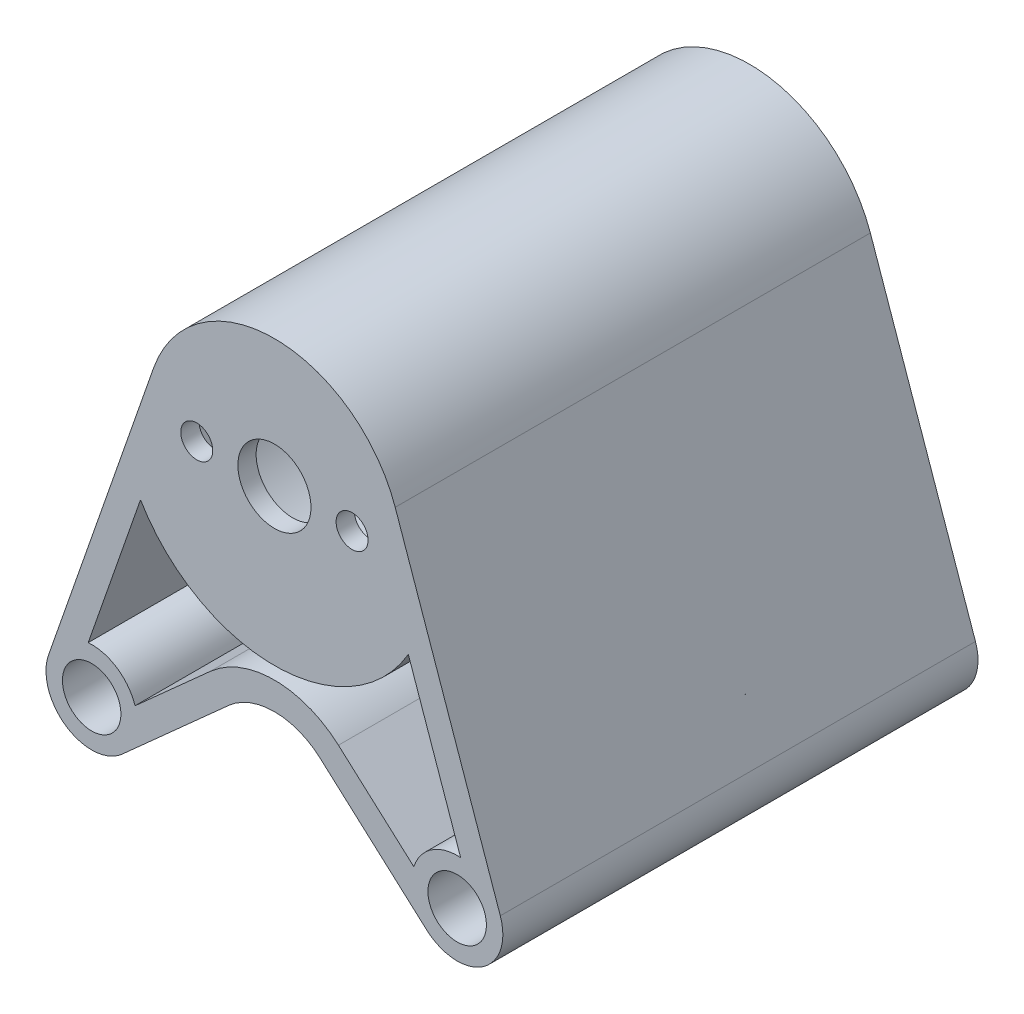
from build123d import *

# Parameters (mm, degrees)
SKETCH3_R           = 14
SKETCH3_R_2         = 1.75
SKETCH3_R_3         = 4
BOSS_EXTRUDE1_DEPTH = 2
BOSS_EXTRUDE2_START = 50
SKETCH4_R           = 14
SKETCH4_R_2         = 12.65
BOSS_EXTRUDE2_DEPTH = 50
BOSS_EXTRUDE3_START = -52
SKETCH5_R           = 3
BOSS_EXTRUDE3_DEPTH = 52
SKETCH6_R           = 13.15
CUT_EXTRUDE1_DEPTH  = 50
SKETCH8_R           = 3.2
SKETCH8_R_2         = 3
CUT_EXTRUDE2_DEPTH  = 52


with BuildPart() as part:
    # Sketch3 → Boss-Extrude1 (new body)
    with BuildSketch(Plane.XY):
        Circle(SKETCH3_R)
        with Locations((8.5, 0)):
            Circle(SKETCH3_R_2, mode=Mode.SUBTRACT)
        with Locations((-8.5, 0)):
            Circle(SKETCH3_R_2, mode=Mode.SUBTRACT)
        Circle(SKETCH3_R_3, mode=Mode.SUBTRACT)
    extrude(amount=BOSS_EXTRUDE1_DEPTH)

    # Sketch4 → Boss-Extrude2 (add)
    with BuildSketch(Plane(origin=(0, 0, 0), x_dir=(-1, 0, 0), z_dir=(0, 0, -1)).offset(BOSS_EXTRUDE2_START)):
        Circle(SKETCH4_R)
        Circle(SKETCH4_R_2, mode=Mode.SUBTRACT)
    extrude(amount=-BOSS_EXTRUDE2_DEPTH)

    # Sketch5 → Boss-Extrude3 (add)
    # profile 1 of 4: a face of its own
    with BuildSketch(Plane.XY.offset(2).offset(BOSS_EXTRUDE3_START)):
        with BuildLine():
            Line((24.720866981, -28.352755346), (13.218427546, 4.612285031))
            ThreePointArc((13.218427546, 4.612285031), (13.803224001, 2.339018422), (14, 0))
            ThreePointArc((14, 0), (-2.339018422, -13.803224001), (-13.218427546, 4.612285031))
            Line((-13.218427546, 4.612285031), (-24.720866981, -28.352755346))
            ThreePointArc((-24.720866981, -28.352755346), (-23.047527639, -26.036090908), (-20.378622129, -25.014356081))
            Line((-20.378622129, -25.014356081), (-14.656053545, -8.613947671))
            ThreePointArc((-14.656053545, -8.613947671), (0, -17), (14.656053545, -8.613947671))
            Line((14.656053545, -8.613947671), (20.378622129, -25.014356081))
            ThreePointArc((20.378622129, -25.014356081), (23.047527639, -26.036090908), (24.720866981, -28.352755346))
        make_face()
    # profile 2 of 4: a face of its own
    with BuildSketch(Plane.XY.offset(2).offset(BOSS_EXTRUDE3_START)):
        with BuildLine():
            Line((5.004377394, -23.279258169), (16.663748404, -33.724167731))
            ThreePointArc((16.663748404, -33.724167731), (15.168880977, -31.288522016), (15.252243256, -28.431941997))
            Line((15.252243256, -28.431941997), (7.006128352, -21.044757531))
            ThreePointArc((7.006128352, -21.044757531), (0, -18.365509765), (-7.006128352, -21.044757531))
            Line((-7.006128352, -21.044757531), (-15.252243256, -28.431941997))
            ThreePointArc((-15.252243256, -28.431941997), (-15.063463577, -29.205891607), (-15, -30))
            ThreePointArc((-15, -30), (-15.434846225, -32.039453606), (-16.663748404, -33.724167731))
            Line((-16.663748404, -33.724167731), (-5.004377394, -23.279258169))
            ThreePointArc((-5.004377394, -23.279258169), (0, -21.365509765), (5.004377394, -23.279258169))
        make_face()
    # profile 3 of 4: a face of its own
    with BuildSketch(Plane.XY.offset(2).offset(BOSS_EXTRUDE3_START)):
        with BuildLine():
            ThreePointArc((-20.378622129, -25.014356081), (-23.047527639, -26.036090908), (-24.720866981, -28.352755346))
            ThreePointArc((-24.720866981, -28.352755346), (-22.773500981, -34.160251472), (-16.663748404, -33.724167731))
            ThreePointArc((-16.663748404, -33.724167731), (-15.434846225, -32.039453606), (-15, -30))
            ThreePointArc((-15, -30), (-15.063463577, -29.205891607), (-15.252243256, -28.431941997))
            ThreePointArc((-15.252243256, -28.431941997), (-17.226499019, -25.839748528), (-20.378622129, -25.014356081))
        make_face()
        with Locations((-20, -30)):
            Circle(SKETCH5_R, mode=Mode.SUBTRACT)
    # profile 4 of 4: a face of its own
    with BuildSketch(Plane.XY.offset(2).offset(BOSS_EXTRUDE3_START)):
        with BuildLine():
            ThreePointArc((25, -30), (24.929722858, -29.164636278), (24.720866981, -28.352755346))
            ThreePointArc((24.720866981, -28.352755346), (23.047527639, -26.036090908), (20.378622129, -25.014356081))
            ThreePointArc((20.378622129, -25.014356081), (17.226499019, -25.839748528), (15.252243256, -28.431941997))
            ThreePointArc((15.252243256, -28.431941997), (15.168880977, -31.288522016), (16.663748404, -33.724167731))
            ThreePointArc((16.663748404, -33.724167731), (22.039453606, -34.565153775), (25, -30))
        make_face()
        with Locations((20, -30)):
            Circle(SKETCH5_R, mode=Mode.SUBTRACT)
    extrude(amount=BOSS_EXTRUDE3_DEPTH)

    # Sketch6 → Cut-Extrude1 (cut)
    with BuildSketch(Plane(origin=(0, 0, -50), x_dir=(-1, 0, 0), z_dir=(0, 0, -1))):
        Circle(SKETCH6_R)
    extrude(amount=-CUT_EXTRUDE1_DEPTH, mode=Mode.SUBTRACT)

    # Sketch8 → Cut-Extrude2 (cut)
    # profile 1 of 4: a face of its own
    with BuildSketch(Plane(origin=(0, 0, -50), x_dir=(-1, 0, 0), z_dir=(0, 0, -1))):
        with Locations((20, -30)):
            Circle(SKETCH8_R)
        with Locations((20, -30)):
            Circle(SKETCH8_R_2, mode=Mode.SUBTRACT)
    # profile 2 of 4: a face of its own
    with BuildSketch(Plane(origin=(0, 0, -50), x_dir=(-1, 0, 0), z_dir=(0, 0, -1))):
        with Locations((-20, -30)):
            Circle(SKETCH8_R)
        with Locations((-20, -30)):
            Circle(SKETCH8_R_2, mode=Mode.SUBTRACT)
    # profile 3 of 4: a face of its own
    with BuildSketch(Plane(origin=(0, 0, -50), x_dir=(-1, 0, 0), z_dir=(0, 0, -1))):
        with Locations((20, -30)):
            Circle(SKETCH8_R_2)
    # profile 4 of 4: a face of its own
    with BuildSketch(Plane(origin=(0, 0, -50), x_dir=(-1, 0, 0), z_dir=(0, 0, -1))):
        with Locations((-20, -30)):
            Circle(SKETCH8_R_2)
    extrude(amount=-CUT_EXTRUDE2_DEPTH, mode=Mode.SUBTRACT)


solid = part.part
